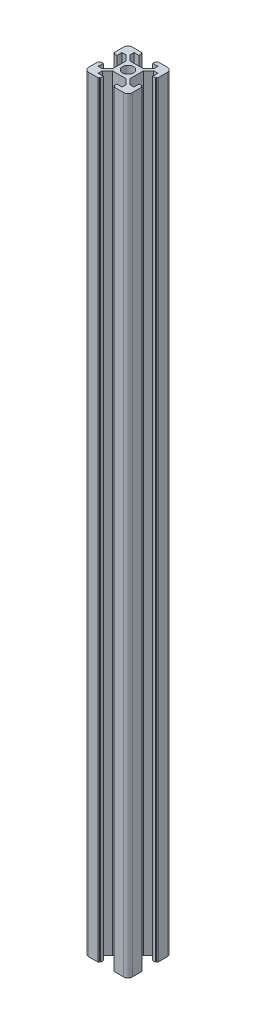
from build123d import *

# Parameters (mm, degrees)
SKETCH_1_R      = 2.5
EXTRUDE_1_DEPTH = 350


with BuildPart() as part:
    # 草图1 → 凸台-拉伸1 (new body)
    with BuildSketch(Plane(origin=(0, 0, 0), x_dir=(1, 0, 0), z_dir=(0, 1, 0))):
        with BuildLine():
            Line((-3.948528137, -3.1), (-6.298528137, -5.45))
            Line((-6.298528137, -5.45), (-8.2, -5.45))
            Line((-8.2, -5.45), (-8.2, -3.1))
            Line((-8.2, -3.1), (-9.5, -3.1))
            Line((-9.5, -3.1), (-9.5, -3.6))
            Line((-9.5, -3.6), (-10, -3.6))
            Line((-10, -3.6), (-10, -8))
            ThreePointArc((-10, -8), (-9.414213562, -9.414213562), (-8, -10))
            Line((-8, -10), (-3.6, -10))
            Line((-3.6, -10), (-3.6, -9.5))
            Line((-3.6, -9.5), (-3.1, -9.5))
            Line((-3.1, -9.5), (-3.1, -8.2))
            Line((-3.1, -8.2), (-5.45, -8.2))
            Line((-5.45, -8.2), (-5.45, -6.298528137))
            Line((-5.45, -6.298528137), (-3.1, -3.948528137))
            Line((-3.1, -3.948528137), (0, -3.948528137))
            Line((0, -3.948528137), (3.1, -3.948528137))
            Line((3.1, -3.948528137), (5.45, -6.298528137))
            Line((5.45, -6.298528137), (5.45, -8.2))
            Line((5.45, -8.2), (3.1, -8.2))
            Line((3.1, -8.2), (3.1, -9.5))
            Line((3.1, -9.5), (3.6, -9.5))
            Line((3.6, -9.5), (3.6, -10))
            Line((3.6, -10), (8, -10))
            ThreePointArc((8, -10), (9.414213562, -9.414213562), (10, -8))
            Line((10, -8), (10, -3.6))
            Line((10, -3.6), (9.5, -3.6))
            Line((9.5, -3.6), (9.5, -3.1))
            Line((9.5, -3.1), (8.2, -3.1))
            Line((8.2, -3.1), (8.2, -5.45))
            Line((8.2, -5.45), (6.298528137, -5.45))
            Line((6.298528137, -5.45), (3.948528137, -3.1))
            Line((3.948528137, -3.1), (3.948528137, 0))
            Line((3.948528137, 0), (3.948528137, 3.1))
            Line((3.948528137, 3.1), (6.298528137, 5.45))
            Line((6.298528137, 5.45), (8.2, 5.45))
            Line((8.2, 5.45), (8.2, 3.1))
            Line((8.2, 3.1), (9.5, 3.1))
            Line((9.5, 3.1), (9.5, 3.6))
            Line((9.5, 3.6), (10, 3.6))
            Line((10, 3.6), (10, 8))
            ThreePointArc((10, 8), (9.414213562, 9.414213562), (8, 10))
            Line((8, 10), (3.6, 10))
            Line((3.6, 10), (3.6, 9.5))
            Line((3.6, 9.5), (3.1, 9.5))
            Line((3.1, 9.5), (3.1, 8.2))
            Line((3.1, 8.2), (5.45, 8.2))
            Line((5.45, 8.2), (5.45, 6.298528137))
            Line((5.45, 6.298528137), (3.1, 3.948528137))
            Line((3.1, 3.948528137), (0, 3.948528137))
            Line((0, 3.948528137), (-3.1, 3.948528137))
            Line((-3.1, 3.948528137), (-5.45, 6.298528137))
            Line((-5.45, 6.298528137), (-5.45, 8.2))
            Line((-5.45, 8.2), (-3.1, 8.2))
            Line((-3.1, 8.2), (-3.1, 9.5))
            Line((-3.1, 9.5), (-3.6, 9.5))
            Line((-3.6, 9.5), (-3.6, 10))
            Line((-3.6, 10), (-8, 10))
            ThreePointArc((-8, 10), (-9.414213562, 9.414213562), (-10, 8))
            Line((-10, 8), (-10, 3.6))
            Line((-10, 3.6), (-9.5, 3.6))
            Line((-9.5, 3.6), (-9.5, 3.1))
            Line((-9.5, 3.1), (-8.2, 3.1))
            Line((-8.2, 3.1), (-8.2, 5.45))
            Line((-8.2, 5.45), (-6.298528137, 5.45))
            Line((-6.298528137, 5.45), (-3.948528137, 3.1))
            Line((-3.948528137, 3.1), (-3.948528137, 0))
            Line((-3.948528137, 0), (-3.948528137, -3.1))
        make_face()
        with Locations(Location((0, 0, 0), (0, 0, 270))):
            Circle(SKETCH_1_R, mode=Mode.SUBTRACT)
    extrude(amount=EXTRUDE_1_DEPTH)


solid = part.part
